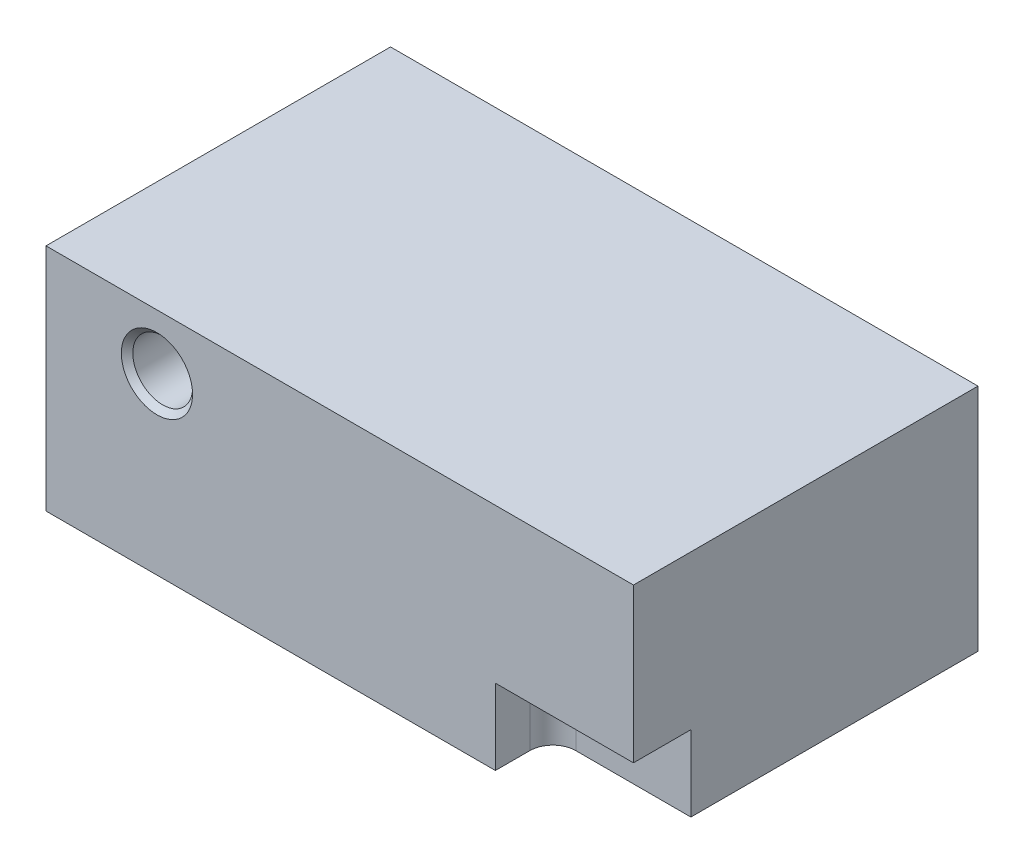
from build123d import *

# Parameters (mm, degrees)
SKETCH1_W           = 1299.221386713
SKETCH1_H           = 762
BOSS_EXTRUDE2_DEPTH = 508
SKETCH3_R           = 90.110640619
BOSS_EXTRUDE4_DEPTH = 762
SKETCH4_R           = 66.065626011
CUT_EXTRUDE1_DEPTH  = 1590.554721201
CHAMFER3_SIZE       = 12.7
SKETCH5_W           = 305.335237322
SKETCH5_H           = 167.392745924
CUT_EXTRUDE2_DEPTH  = 127
FILLET3_R           = 50.8


with BuildPart() as part:
    # Sketch1 → Boss-Extrude2 (new body)
    with BuildSketch(Plane(origin=(0, 0, 0), x_dir=(1, 0, 0), z_dir=(0, 1, 0))):
        with Locations((649.610693357, -381)):
            Rectangle(SKETCH1_W, SKETCH1_H)
    extrude(amount=BOSS_EXTRUDE2_DEPTH)

    # Sketch3 → Boss-Extrude4 (add, through all)
    with BuildSketch(Plane.XY.offset(762)):
        with Locations((199.400638449, 376.804670273)):
            Circle(SKETCH3_R)
    extrude(amount=-BOSS_EXTRUDE4_DEPTH)

    # Sketch4 → Cut-Extrude1 (cut, through all)
    with BuildSketch(Plane.XY.offset(762)):
        with Locations((245.395602091, 385.783170349)):
            Circle(SKETCH4_R)
    extrude(amount=-CUT_EXTRUDE1_DEPTH, mode=Mode.SUBTRACT)

    # Chamfer3
    chamfer3_edges = [part.edges().sort_by_distance(p)[0] for p in [
        (179.329976081, 385.783170349, 0),
        (179.329976081, 385.783170349, 762),
    ]]
    chamfer(chamfer3_edges, length=CHAMFER3_SIZE)

    # Sketch5 → Cut-Extrude2 (cut)
    with BuildSketch(Plane.XY.offset(762)):
        with Locations((1146.553768052, 83.696372962)):
            Rectangle(SKETCH5_W, SKETCH5_H)
    extrude(amount=-CUT_EXTRUDE2_DEPTH, mode=Mode.SUBTRACT)

    # Fillet3
    fillet3_edges = [part.edges().sort_by_distance(p)[0] for p in [
        (993.886149391, 83.696372962, 635),
    ]]
    fillet(fillet3_edges, radius=FILLET3_R)


solid = part.part
